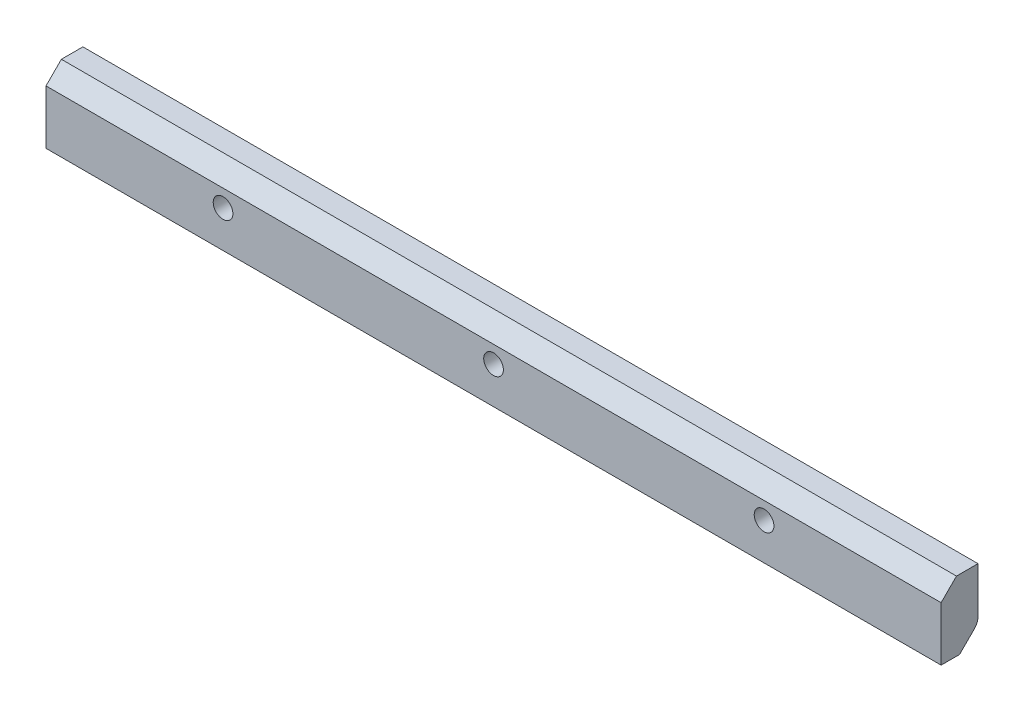
from build123d import *

# Parameters (mm, degrees)
SKETCH1_W                       = 2
SKETCH1_H                       = 6.4
BOSS_EXTRUDE1_DEPTH             = 36.4
CUT_EXTRUDE8_DEPTH              = 37.595081637
CUT_EXTRUDE8_DEPTH_BACK         = 37.595081637
SKETCH15_W                      = 2
SKETCH15_H                      = 0.75
CUT_EXTRUDE5_DEPTH              = 72.8
M2X0_4_TAPPED_HOLE1_D           = 1.6
M2X0_4_TAPPED_HOLE1_DEPTH       = 3.6
M2X0_4_TAPPED_HOLE1_TIP         = 0.480688495
CUT_EXTRUDE9_DEPTH              = 37.595081637
CUT_EXTRUDE9_DEPTH_BACK         = 37.595081637
BOSS_EXTRUDE8_REACH             = 38.595
BOSS_EXTRUDE8_DIRECTION_2_REACH = 38.595
FILLET7_R                       = 1


with BuildPart() as part:
    # Sketch1 → Boss-Extrude1 (new, symmetric)
    with BuildSketch(Plane(origin=(0, 0, 0), x_dir=(0, 0, -1), z_dir=(1, 0, 0))):
        with Locations((-1, 0)):
            Rectangle(SKETCH1_W, SKETCH1_H)
    extrude(amount=BOSS_EXTRUDE1_DEPTH, both=True)

    # Sketch15 → Cut-Extrude8 (cut, two sides: drawn at the far end of the back side and taken through both)
    with BuildSketch(Plane(origin=(0, 0, 0), x_dir=(0, 0, -1), z_dir=(1, 0, 0)).offset(-CUT_EXTRUDE8_DEPTH_BACK)):
        with Locations((-1, 2.825)):
            Rectangle(SKETCH15_W, SKETCH15_H)
    extrude(amount=CUT_EXTRUDE8_DEPTH + CUT_EXTRUDE8_DEPTH_BACK, mode=Mode.SUBTRACT)

    # Sketch5 → Cut-Extrude5 (cut)
    with BuildSketch(Plane.ZY.offset(36.4)):
        Polygon((0, -3.2), (0.5, -3.2), (0, -2.7), align=None)
    extrude(amount=-CUT_EXTRUDE5_DEPTH, mode=Mode.SUBTRACT)

    # M2x0.4 Tapped Hole1
    with Locations(Plane.XY.offset(2)):
        with Locations((-22, -0.2), (22, -0.2), (0, -0.2)):
            Hole(M2X0_4_TAPPED_HOLE1_D / 2, depth=M2X0_4_TAPPED_HOLE1_DEPTH)
            with Locations((0, 0, -(M2X0_4_TAPPED_HOLE1_DEPTH + M2X0_4_TAPPED_HOLE1_TIP / 2))):  # 118° drill point
                Cone(0, M2X0_4_TAPPED_HOLE1_D / 2, M2X0_4_TAPPED_HOLE1_TIP, mode=Mode.SUBTRACT)

    # Sketch16 → Cut-Extrude9 (cut, two sides: drawn at the far end of the back side and taken through both)
    with BuildSketch(Plane(origin=(0, 0, 0), x_dir=(0, 0, -1), z_dir=(1, 0, 0)).offset(-CUT_EXTRUDE9_DEPTH_BACK)):
        Polygon((0, 3.2), (-2, 3.2), (-2, 1.2), align=None)
    extrude(amount=CUT_EXTRUDE9_DEPTH + CUT_EXTRUDE9_DEPTH_BACK, mode=Mode.SUBTRACT)

    # Boss-Extrude8: up to this face of the body (flat: up to its plane)
    boss_extrude8_end = Plane(part.part.faces().sort_by_distance((36.4, -0.524052916, 0.966175586))[0])
    # Sketch17 → Boss-Extrude8 (add, up to the picked face)
    with BuildSketch(Plane(origin=(0, 0, 0), x_dir=(0, 0, -1), z_dir=(1, 0, 0)), mode=Mode.PRIVATE) as boss_extrude8_sk1:
        Polygon((0, 2.45), (1, 2.45), (1, -1.7), (0, -2.7), align=None)
    boss_extrude8_tool1 = split(extrude(boss_extrude8_sk1.sketch, amount=BOSS_EXTRUDE8_REACH, mode=Mode.PRIVATE), bisect_by=boss_extrude8_end, keep=Keep.BOTH, mode=Mode.PRIVATE)
    add(boss_extrude8_tool1.solids().sort_by(Axis((0, 0.116039, -0.482079), (1, 0, 0)))[0])

    # Boss-Extrude8 direction 2: up to this face of the body (flat: up to its plane)
    boss_extrude8_direction_2_end = Plane(part.part.faces().sort_by_distance((-36.4, -0.524052916, 0.966175586))[0])
    # Sketch17 → Boss-Extrude8 direction 2 (add, up to the picked face)
    with BuildSketch(Plane(origin=(0, 0, 0), x_dir=(0, 0, -1), z_dir=(1, 0, 0)), mode=Mode.PRIVATE) as boss_extrude8_direction_2_sk1:
        Polygon((0, 2.45), (1, 2.45), (1, -1.7), (0, -2.7), align=None)
    boss_extrude8_direction_2_tool1 = split(extrude(boss_extrude8_direction_2_sk1.sketch, amount=-BOSS_EXTRUDE8_DIRECTION_2_REACH, mode=Mode.PRIVATE), bisect_by=boss_extrude8_direction_2_end, keep=Keep.BOTH, mode=Mode.PRIVATE)
    add(boss_extrude8_direction_2_tool1.solids().sort_by(Axis((0, 0.116039, -0.482079), (-1, 0, 0)))[0])

    # Fillet7
    fillet7_edges = [part.edges().sort_by_distance(p)[0] for p in [
        (0, -1.7, -1),
    ]]
    fillet(fillet7_edges, radius=FILLET7_R)


solid = part.part
